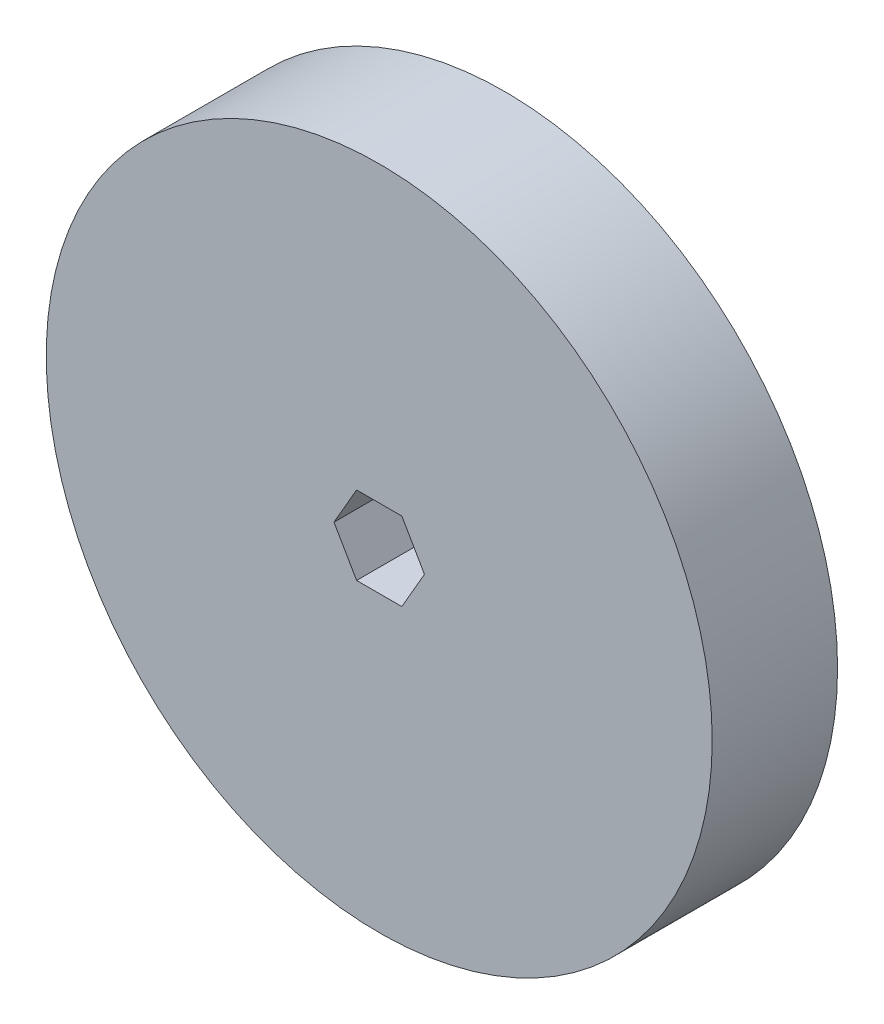
from build123d import *

# Parameters (mm, degrees)
SKETCH1_R           = 21.25
BOSS_EXTRUDE1_DEPTH = 8


with BuildPart() as part:
    # Sketch1 → Boss-Extrude1 (new body)
    with BuildSketch(Plane.XY):
        Circle(SKETCH1_R)
        Polygon((2.886751346, 0), (1.443375673, 2.5), (-1.443375673, 2.5), (-2.886751346, 0), (-1.443375673, -2.5), (1.443375673, -2.5), align=None, mode=Mode.SUBTRACT)
    extrude(amount=BOSS_EXTRUDE1_DEPTH)


solid = part.part
